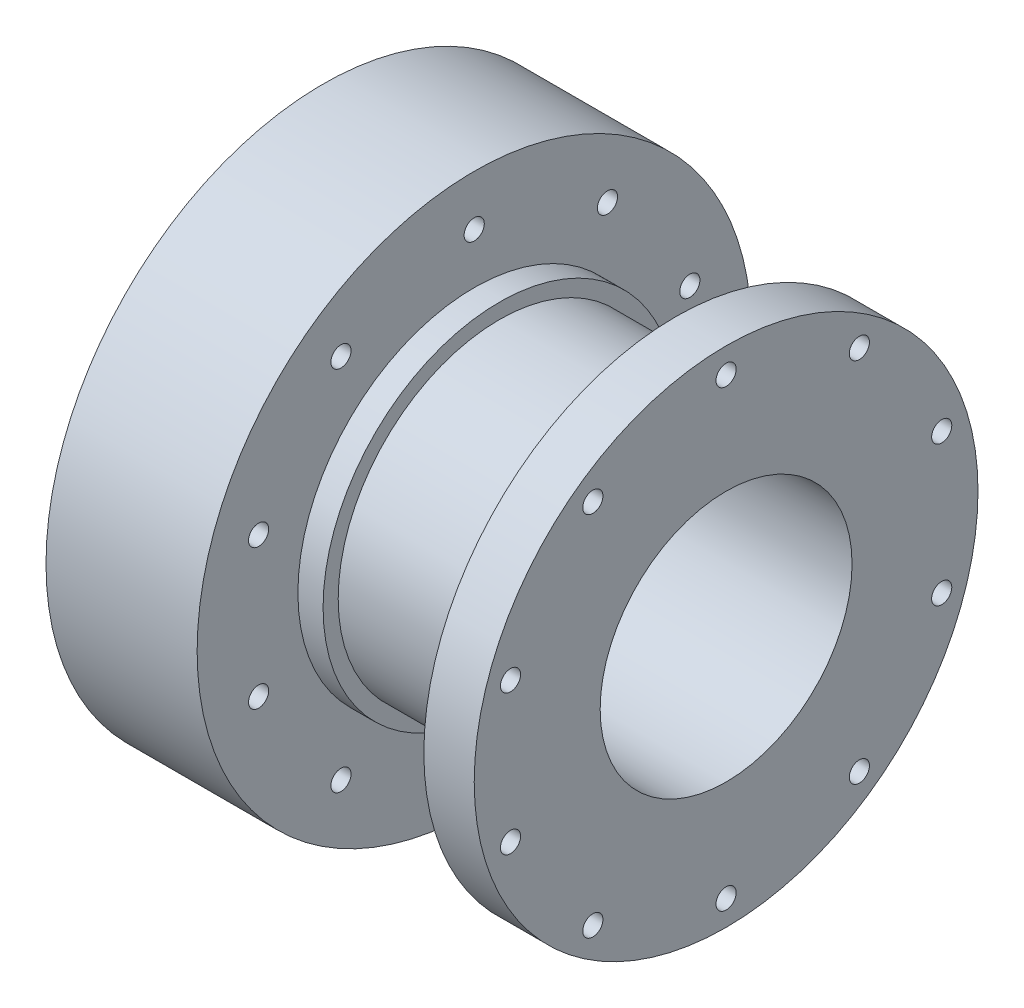
from build123d import *

# Parameters (mm, degrees)
SKETCH2_R          = 2
CUT_EXTRUDE1_DEPTH = 112.579568022


with BuildPart() as part:
    # Sketch1 → Revolve1 (revolve)
    with BuildSketch(Plane.XY, mode=Mode.PRIVATE) as revolve1_sk:
        Polygon((72.612826049, 25), (72.612826049, 50), (62.612826049, 50), (62.612826049, 35), (57.612826049, 35), (57.612826049, 32), (27.612826049, 32), (27.612826049, 35), (22.612826049, 35), (22.612826049, 55), (-7.387173951, 55), (-7.387173951, 50), (12.612826049, 50), (12.612826049, 40), (-7.387173951, 40), (-7.387173951, 35), (12.612826049, 35), (12.612826049, 25), align=None)
    revolve(revolve1_sk.sketch.rotate(Axis((-41.889027365, 0, 0), (1, 0, 0)), 90), axis=Axis((-41.889027365, 0, 0), (1, 0, 0)))

    # Sketch2 → Cut-Extrude1 (cut, through all)
    with BuildSketch(Plane(origin=(72.612826049, 0, 0), x_dir=(0, 0, -1), z_dir=(1, 0, 0))):
        with Locations((0, 45)):
            Circle(SKETCH2_R)
        with Locations((26.450336353, 36.405764747)):
            Circle(SKETCH2_R)
        with Locations((42.797543233, 13.905764747)):
            Circle(SKETCH2_R)
        with Locations((42.797543233, -13.905764747)):
            Circle(SKETCH2_R)
        with Locations((26.450336353, -36.405764747)):
            Circle(SKETCH2_R)
        with Locations((0, -45)):
            Circle(SKETCH2_R)
        with Locations((-26.450336353, -36.405764747)):
            Circle(SKETCH2_R)
        with Locations((-42.797543233, -13.905764747)):
            Circle(SKETCH2_R)
        with Locations((-42.797543233, 13.905764747)):
            Circle(SKETCH2_R)
        with Locations((-26.450336353, 36.405764747)):
            Circle(SKETCH2_R)
    extrude(amount=-CUT_EXTRUDE1_DEPTH, mode=Mode.SUBTRACT)


solid = part.part
